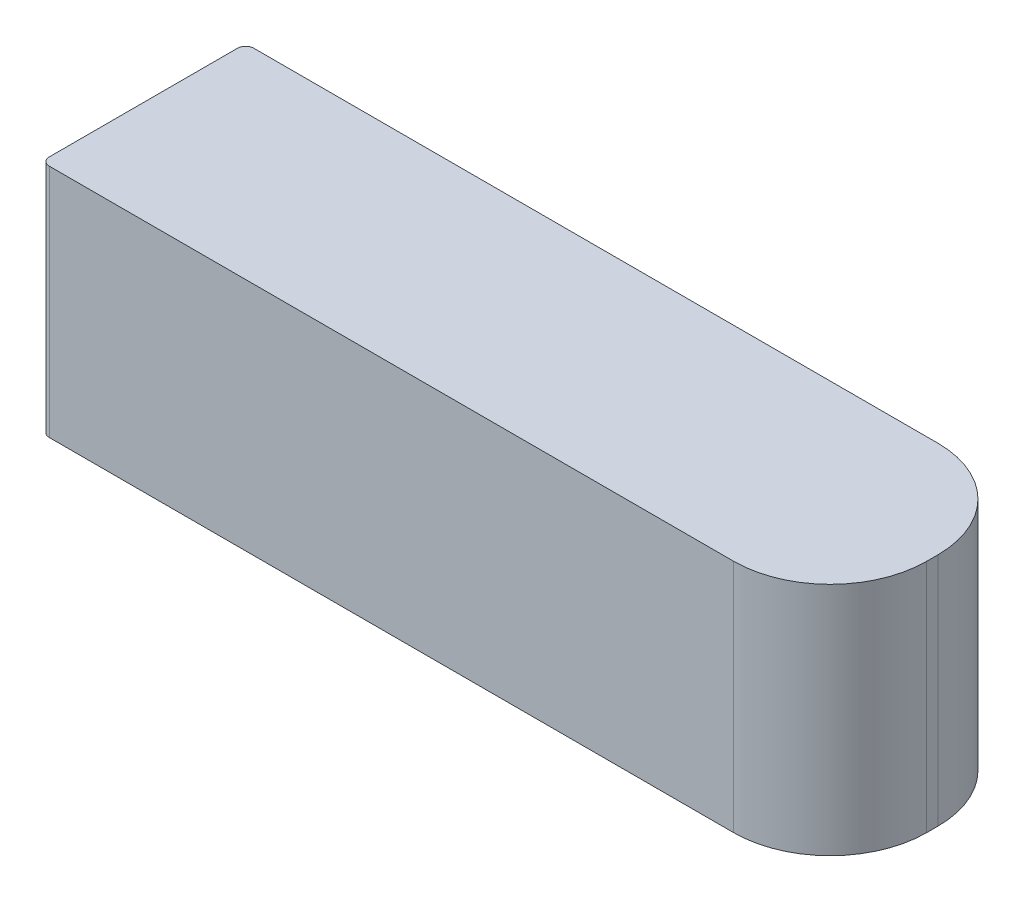
from build123d import *

# Parameters (mm, degrees)
SKETCH1_W           = 98.044
SKETCH1_H           = 25.4
BOSS_EXTRUDE1_DEPTH = 29.21
FILLET1_R           = 12
FILLET2_R           = 1


with BuildPart() as part:
    # Sketch1 → Boss-Extrude1 (new body)
    with BuildSketch(Plane(origin=(0, 0, 0), x_dir=(1, 0, 0), z_dir=(0, 1, 0))):
        Rectangle(SKETCH1_W, SKETCH1_H)
    extrude(amount=BOSS_EXTRUDE1_DEPTH)

    # Fillet1
    fillet1_edges = [part.edges().sort_by_distance(p)[0] for p in [
        (49.022, 14.605, 12.7),
        (49.022, 14.605, -12.7),
    ]]
    fillet(fillet1_edges, radius=FILLET1_R)

    # Fillet2
    fillet2_edges = [part.edges().sort_by_distance(p)[0] for p in [
        (-49.022, 14.605, 12.7),
        (-49.022, 14.605, -12.7),
    ]]
    fillet(fillet2_edges, radius=FILLET2_R)


solid = part.part
